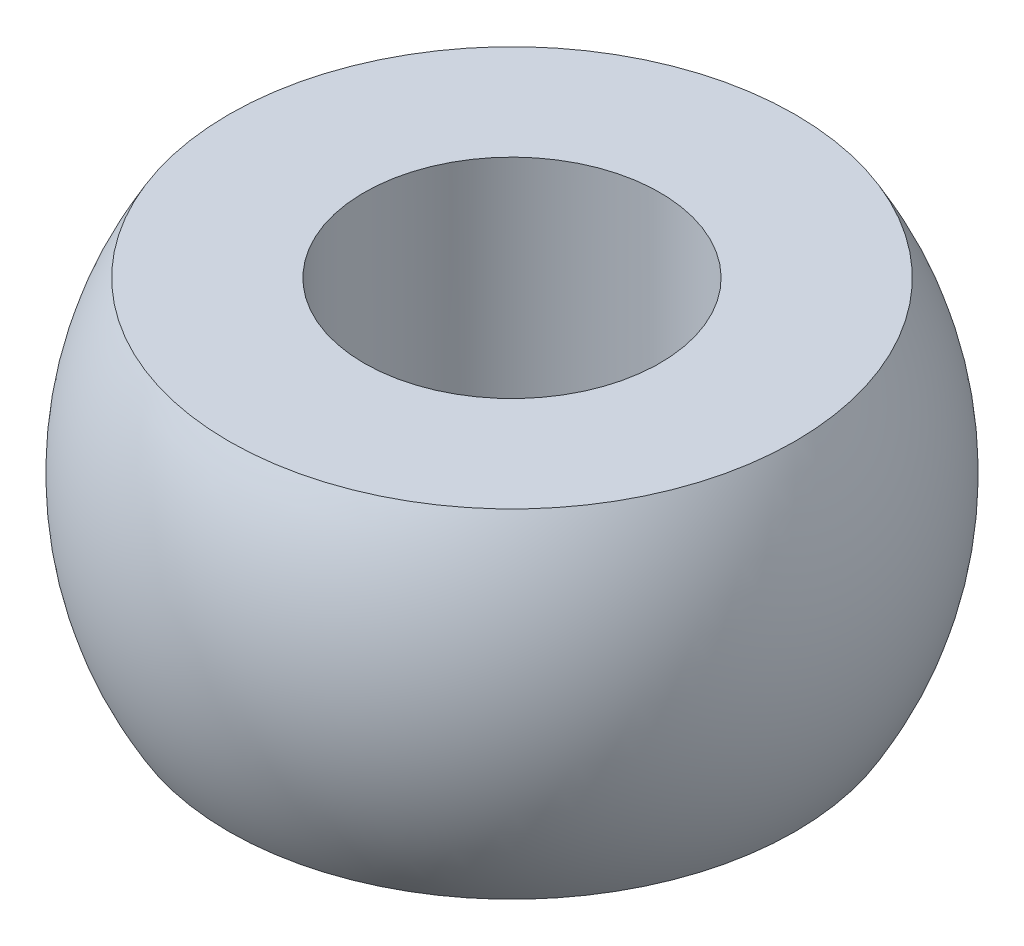
from build123d import *

# Parameters (mm, degrees)
SKETCH2_R          = 1.75
CUT_EXTRUDE1_DEPTH = 10


with BuildPart() as part:
    # Sketch1 → Revolve1 (revolve)
    with BuildSketch(Plane(origin=(0, 0, 0), x_dir=(0, 0, -1), z_dir=(1, 0, 0))):
        with BuildLine():
            Line((0, 2), (0, -2))
            Line((0, -2), (-3.35, -2))
            ThreePointArc((-3.35, -2), (-3.901602235, 0), (-3.35, 2))
            Line((-3.35, 2), (0, 2))
        make_face()
    revolve(axis=Axis((0, 2, 0), (0, -1, 0)))

    # Sketch2 → Cut-Extrude1 (cut)
    with BuildSketch(Plane(origin=(0, 2, 0), x_dir=(1, 0, 0), z_dir=(0, 1, 0))):
        with Locations(Location((0, 0, 0), (0, 0, 270))):
            Circle(SKETCH2_R)
    extrude(amount=-CUT_EXTRUDE1_DEPTH, mode=Mode.SUBTRACT)


solid = part.part
